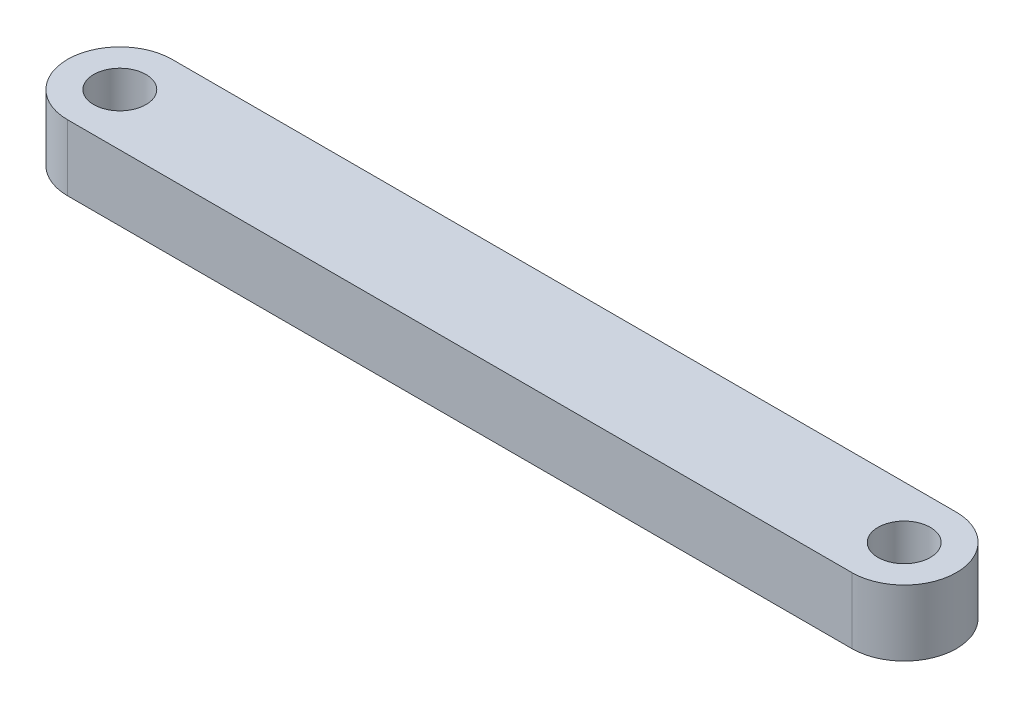
from build123d import *

# Parameters (mm, degrees)
SKETCH1_R           = 1.27
BOSS_EXTRUDE1_DEPTH = 3.2004


with BuildPart() as part:
    # Sketch1 → Boss-Extrude1 (new body)
    with BuildSketch(Plane(origin=(0, 0, 0), x_dir=(1, 0, 0), z_dir=(0, 1, 0))):
        with BuildLine():
            Line((-31.75, -2.54), (6.35, -2.54))
            ThreePointArc((6.35, -2.54), (8.89, 0), (6.35, 2.54))
            Line((6.35, 2.54), (-31.75, 2.54))
            ThreePointArc((-31.75, 2.54), (-34.29, 0), (-31.75, -2.54))
        make_face()
        with Locations(Location((-31.75, 0, 0), (0, 0, 270))):
            Circle(SKETCH1_R, mode=Mode.SUBTRACT)
        with Locations(Location((6.35, 0, 0), (0, 0, 270))):
            Circle(SKETCH1_R, mode=Mode.SUBTRACT)
    extrude(amount=BOSS_EXTRUDE1_DEPTH)


solid = part.part
